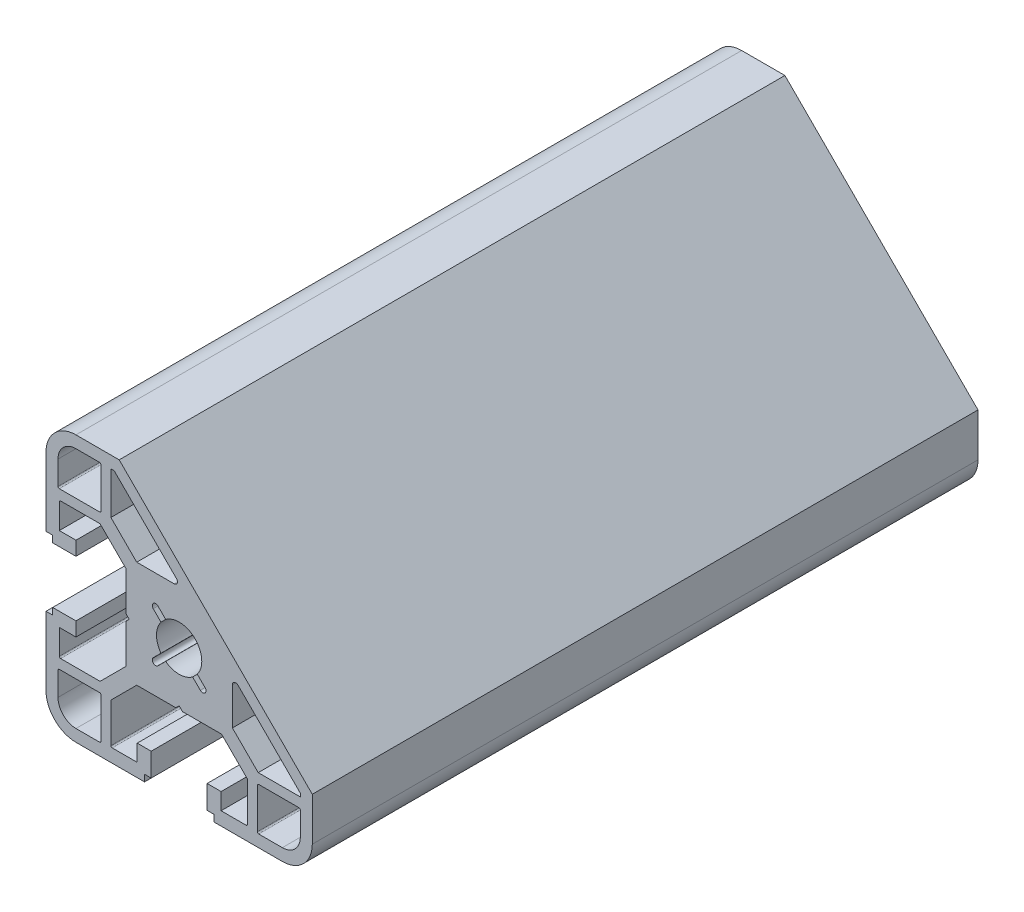
from build123d import *

# Parameters (mm, degrees)
EXTRUDE_1_DEPTH = 100


with BuildPart() as part:
    # 草图1 → 凸台-拉伸1 (new body)
    with BuildSketch(Plane.XY):
        with BuildLine():
            Line((-20, -15.5), (-20, -5.2))
            Line((-20, -5.2), (-19, -5.2))
            Line((-19, -5.2), (-19, -4.2))
            Line((-19, -4.2), (-15.5, -4.2))
            Line((-15.5, -4.2), (-15.5, -6.3))
            Line((-15.5, -6.3), (-18, -6.3))
            Line((-18, -6.3), (-18, -10.05))
            ThreePointArc((-18, -10.05), (-17.941421356, -10.191421356), (-17.8, -10.25))
            Line((-17.8, -10.25), (-11.876345597, -10.25))
            Line((-11.876345597, -10.25), (-8, -6.373654403))
            Line((-8, -6.373654403), (-8, -0.5))
            Line((-8, -0.5), (-7.5, 0))
            Line((-7.5, 0), (-8, 0.5))
            Line((-8, 0.5), (-8, 6.373654403))
            Line((-8, 6.373654403), (-11.876345597, 10.25))
            Line((-11.876345597, 10.25), (-17.8, 10.25))
            ThreePointArc((-17.8, 10.25), (-17.941421356, 10.191421356), (-18, 10.05))
            Line((-18, 10.05), (-18, 6.3))
            Line((-18, 6.3), (-15.5, 6.3))
            Line((-15.5, 6.3), (-15.5, 4.2))
            Line((-15.5, 4.2), (-19, 4.2))
            Line((-19, 4.2), (-19, 5.2))
            Line((-19, 5.2), (-20, 5.2))
            Line((-20, 5.2), (-20, 15.5))
            ThreePointArc((-20, 15.5), (-18.681980515, 18.681980515), (-15.5, 20))
            Line((-15.5, 20), (-9.004415588, 20))
            Line((-9.004415588, 20), (20, -9.004415588))
            Line((20, -9.004415588), (20, -15.5))
            ThreePointArc((20, -15.5), (18.681980515, -18.681980515), (15.5, -20))
            Line((15.5, -20), (5.2, -20))
            Line((5.2, -20), (5.2, -19))
            Line((5.2, -19), (4.2, -19))
            Line((4.2, -19), (4.2, -15.5))
            Line((4.2, -15.5), (6.3, -15.5))
            Line((6.3, -15.5), (6.3, -18))
            Line((6.3, -18), (10.05, -18))
            ThreePointArc((10.05, -18), (10.191421356, -17.941421356), (10.25, -17.8))
            Line((10.25, -17.8), (10.25, -11.876345597))
            Line((10.25, -11.876345597), (6.373654403, -8))
            Line((6.373654403, -8), (0.5, -8))
            Line((0.5, -8), (0, -7.5))
            Line((0, -7.5), (-0.5, -8))
            Line((-0.5, -8), (-6.373654403, -8))
            Line((-6.373654403, -8), (-10.25, -11.876345597))
            Line((-10.25, -11.876345597), (-10.25, -17.8))
            ThreePointArc((-10.25, -17.8), (-10.191421356, -17.941421356), (-10.05, -18))
            Line((-10.05, -18), (-6.3, -18))
            Line((-6.3, -18), (-6.3, -15.5))
            Line((-6.3, -15.5), (-4.2, -15.5))
            Line((-4.2, -15.5), (-4.2, -19))
            Line((-4.2, -19), (-5.2, -19))
            Line((-5.2, -19), (-5.2, -20))
            Line((-5.2, -20), (-15.5, -20))
            ThreePointArc((-15.5, -20), (-18.681980515, -18.681980515), (-20, -15.5))
        make_face()
        with BuildLine():
            Line((-18.2, -15.5), (-18.2, -11.95))
            ThreePointArc((-18.2, -11.95), (-18.141421356, -11.808578644), (-18, -11.75))
            Line((-18, -11.75), (-11.95, -11.75))
            ThreePointArc((-11.95, -11.75), (-11.808578644, -11.808578644), (-11.75, -11.95))
            Line((-11.75, -11.95), (-11.75, -18))
            ThreePointArc((-11.75, -18), (-11.808578644, -18.141421356), (-11.95, -18.2))
            Line((-11.95, -18.2), (-15.5, -18.2))
            ThreePointArc((-15.5, -18.2), (-17.409188309, -17.409188309), (-18.2, -15.5))
        make_face(mode=Mode.SUBTRACT)
        with BuildLine():
            Line((-18.2, 15.5), (-18.2, 11.95))
            ThreePointArc((-18.2, 11.95), (-18.141421356, 11.808578644), (-18, 11.75))
            Line((-18, 11.75), (-11.95, 11.75))
            ThreePointArc((-11.95, 11.75), (-11.808578644, 11.808578644), (-11.75, 11.95))
            Line((-11.75, 11.95), (-11.75, 18))
            ThreePointArc((-11.75, 18), (-11.808578644, 18.141421356), (-11.95, 18.2))
            Line((-11.95, 18.2), (-15.5, 18.2))
            ThreePointArc((-15.5, 18.2), (-17.409188309, 17.409188309), (-18.2, 15.5))
        make_face(mode=Mode.SUBTRACT)
        with BuildLine():
            Line((-6.373654403, 8), (-10.25, 11.876345597))
            Line((-10.25, 11.876345597), (-10.25, 18.2))
            Line((-10.25, 18.2), (-9.75, 18.2))
            Line((-9.75, 18.2), (-0.403553391, 8.853553391))
            ThreePointArc((-0.403553391, 8.853553391), (-0.295167015, 8.308658284), (-0.757106781, 8))
            Line((-0.757106781, 8), (-6.373654403, 8))
        make_face(mode=Mode.SUBTRACT)
        with BuildLine():
            Line((8, -6.373654403), (11.876345597, -10.25))
            Line((11.876345597, -10.25), (18.2, -10.25))
            Line((18.2, -10.25), (18.2, -9.75))
            Line((18.2, -9.75), (8.853553391, -0.403553391))
            ThreePointArc((8.853553391, -0.403553391), (8.308658284, -0.295167015), (8, -0.757106781))
            Line((8, -0.757106781), (8, -6.373654403))
        make_face(mode=Mode.SUBTRACT)
        with BuildLine():
            Line((-3.181980515, -3.889087297), (-2.024471, -2.731577781))
            ThreePointArc((-2.024471, -2.731577781), (0, -3.4), (2.024471, -2.731577781))
            Line((2.024471, -2.731577781), (3.181980515, -3.889087297))
            ThreePointArc((3.181980515, -3.889087297), (3.889087297, -3.889087297), (3.889087297, -3.181980515))
            Line((3.889087297, -3.181980515), (2.731577781, -2.024471))
            ThreePointArc((2.731577781, -2.024471), (2.404163056, 2.404163056), (-2.024471, 2.731577781))
            Line((-2.024471, 2.731577781), (-3.181980515, 3.889087297))
            ThreePointArc((-3.181980515, 3.889087297), (-3.889087297, 3.889087297), (-3.889087297, 3.181980515))
            Line((-3.889087297, 3.181980515), (-2.731577781, 2.024471))
            ThreePointArc((-2.731577781, 2.024471), (-3.4, 0), (-2.731577781, -2.024471))
            Line((-2.731577781, -2.024471), (-3.889087297, -3.181980515))
            ThreePointArc((-3.889087297, -3.181980515), (-3.889087297, -3.889087297), (-3.181980515, -3.889087297))
        make_face(mode=Mode.SUBTRACT)
        with BuildLine():
            Line((15.5, -18.2), (11.95, -18.2))
            ThreePointArc((11.95, -18.2), (11.808578644, -18.141421356), (11.75, -18))
            Line((11.75, -18), (11.75, -11.95))
            ThreePointArc((11.75, -11.95), (11.808578644, -11.808578644), (11.95, -11.75))
            Line((11.95, -11.75), (18, -11.75))
            ThreePointArc((18, -11.75), (18.141421356, -11.808578644), (18.2, -11.95))
            Line((18.2, -11.95), (18.2, -15.5))
            ThreePointArc((18.2, -15.5), (17.409188309, -17.409188309), (15.5, -18.2))
        make_face(mode=Mode.SUBTRACT)
    extrude(amount=EXTRUDE_1_DEPTH)


solid = part.part
